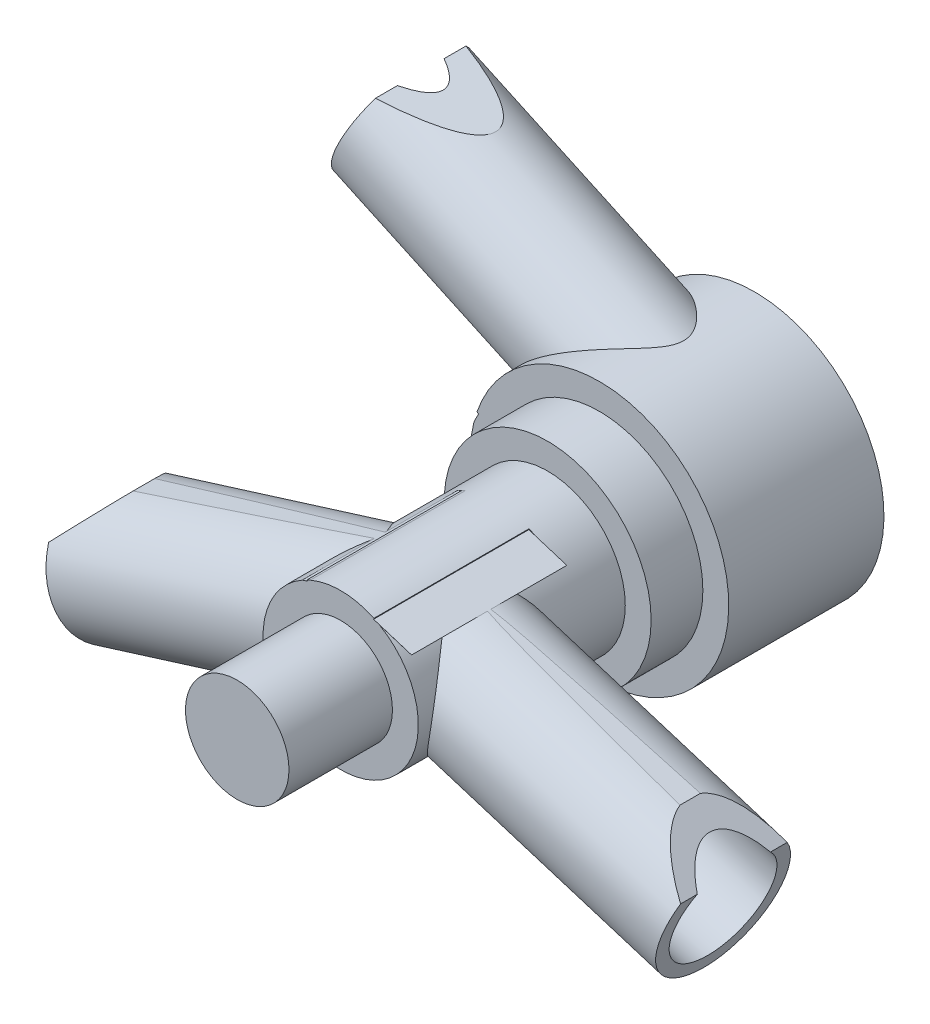
from build123d import *
from build123d.topology import SkipClean

# Parameters (mm, degrees)
SKETCH1_R                = 63.5
BOSS_EXTRUDE1_DEPTH      = 50.8
SKETCH3_R                = 50.8
BOSS_EXTRUDE2_DEPTH      = 25.4
SKETCH4_R                = 38.1
BOSS_EXTRUDE3_DEPTH      = 101.6
SKETCH5_R                = 25.4
BOSS_EXTRUDE4_DEPTH      = 50.8
BOSS_EXTRUDE8_START      = -76.2
BOSS_EXTRUDE8_DEPTH      = 76.2
CUT_EXTRUDE11_REACH      = 400.151
CUT_EXTRUDE11_END_RADIUS = 38.1
SKETCH14_W               = 149.462783348
SKETCH14_H               = 76.2
CUT_EXTRUDE14_DEPTH      = 0.508
CUT_EXTRUDE15_REACH      = 400.151
CUT_EXTRUDE15_END_RADIUS = 38.1
CUT_EXTRUDE16_REACH      = 400.177
CUT_EXTRUDE16_END_RADIUS = 38.1
SKETCH18_W               = 149.619958318
SKETCH18_H               = 76.2
CUT_EXTRUDE17_DEPTH      = 0.508
SKETCH19_R               = 25.4
CUT_EXTRUDE18_DEPTH      = 101.6
SKETCH20_R               = 25.4
CUT_EXTRUDE19_DEPTH      = 101.6
CUT_EXTRUDE22_DEPTH      = 254
BOSS_EXTRUDE9_START      = 25.4
SKETCH22_R               = 63.5
BOSS_EXTRUDE9_DEPTH      = 25.4
BOSS_EXTRUDE10_DEPTH     = 76.2
CUT_EXTRUDE23_REACH      = 405.156
CUT_EXTRUDE23_END_RADIUS = 63.5
SKETCH25_W               = 76.2
SKETCH25_H               = 71.543766187
SKETCH25_R               = 31.75
SKETCH26_W               = 99.244738203
SKETCH26_H               = 76.2
CUT_EXTRUDE24_DEPTH      = 2.54
SKETCH27_W               = 18.769862002
SKETCH27_H               = 76.2
CUT_EXTRUDE25_DEPTH      = 2.54
SKETCH28_R               = 25.4
CUT_EXTRUDE26_DEPTH      = 76.2
CUT_EXTRUDE27_DEPTH      = 50.8


with BuildPart() as part:
    # Sketch1 → Boss-Extrude1 (new body)
    with BuildSketch(Plane.XY):
        Circle(SKETCH1_R)
    extrude(amount=BOSS_EXTRUDE1_DEPTH)

    # Sketch3 → Boss-Extrude2 (add)
    with BuildSketch(Plane.XY.offset(50.8)):
        Circle(SKETCH3_R)
    extrude(amount=BOSS_EXTRUDE2_DEPTH)

    # Sketch4 → Boss-Extrude3 (add)
    with BuildSketch(Plane.XY.offset(76.2)):
        Circle(SKETCH4_R)
    extrude(amount=BOSS_EXTRUDE3_DEPTH)

    # Sketch5 → Boss-Extrude4 (add)
    with BuildSketch(Plane.XY.offset(177.8)):
        Circle(SKETCH5_R)
    extrude(amount=BOSS_EXTRUDE4_DEPTH)

    # Sketch8 → Boss-Extrude8 (add)
    with BuildSketch(Plane.XY.offset(177.8).offset(BOSS_EXTRUDE8_START)):
        with BuildLine():
            Line((16.300217306, 34.437086343), (127.497415133, -0.541997387))
            Line((127.497415133, -0.541997387), (159.018921737, -10.479544971))
            Line((159.018921737, -10.479544971), (140.197415126, -71.104671892))
            Line((140.197415126, -71.104671892), (19.05, -32.995567884))
            ThreePointArc((19.05, -32.995567884), (38.068361928, 1.552359521), (16.300217306, 34.437086343))
        make_face()
        with BuildLine():
            Line((-19.05, -32.995567884), (-140.197415132, -71.104671873))
            Line((-140.197415132, -71.104671873), (-159.088506914, -10.479544949))
            Line((-159.088506914, -10.479544949), (-127.497415131, -0.541997371))
            Line((-127.497415131, -0.541997371), (-16.513468637, 34.370004287))
            add(Edge.make_bspline(
                [(-16.513468637, 34.370004287), (-15.7344976, 34.722682489), (-14.95550815, 35.042014439)],
                knots=[0, 0, 0, 0.047490239, 0.047490239, 0.047490239], degree=2))
            ThreePointArc((-14.95550815, 35.042014439), (-38.031195067, 2.288711811), (-19.05, -32.995567884))
        make_face()
    extrude(amount=BOSS_EXTRUDE8_DEPTH)

    # Cut-Extrude11: up to this cylinder (the profile starts outside it)
    cut_extrude11_end = Plane(origin=(0, 0, 158.75), z_dir=(0, 0, -1)) * Cylinder(CUT_EXTRUDE11_END_RADIUS, 877.502, mode=Mode.PRIVATE)
    # Sketch12 → Cut-Extrude11 (cut, up to the surface)
    with BuildSketch(Plane(origin=(-147.984988274, -46.112860091, 0), x_dir=(0, 0, 1), z_dir=(-0.9547229320618802, -0.297496425180483, 0)), mode=Mode.PRIVATE) as cut_extrude11_sk1:
        with BuildLine():
            Line((139.7, -26.177030992), (177.8, -26.177030992))
            Line((177.8, -26.177030992), (177.8, 37.323200213))
            Line((177.8, 37.323200213), (139.7, 37.323200213))
            ThreePointArc((139.7, 37.323200213), (162.150722046, 28.023806657), (171.450115603, 5.573084611))
            ThreePointArc((171.450115603, 5.573084611), (162.150722046, -16.877637436), (139.7, -26.177030992))
        make_face()
    cut_extrude11_tool1 = extrude(cut_extrude11_sk1.sketch, amount=-CUT_EXTRUDE11_REACH, mode=Mode.PRIVATE) - cut_extrude11_end
    add(cut_extrude11_tool1.solids().sort_by_distance((-140.417721, -70.397668, 158.75))[0], mode=Mode.SUBTRACT)

    # Sketch14 → Cut-Extrude14 (cut)
    with BuildSketch(Plane(origin=(-11.325108646, 36.00209648, 0), x_dir=(0.9539166545833222, 0.3000716849497182, 0), z_dir=(-0.3000716849497182, 0.9539166545833222, 0))):
        with Locations((-80.170399334, -139.7)):
            Rectangle(SKETCH14_W, SKETCH14_H)
    extrude(amount=-CUT_EXTRUDE14_DEPTH, mode=Mode.SUBTRACT)

    # Cut-Extrude15: up to this cylinder (the profile starts outside it)
    cut_extrude15_end = Plane(origin=(0, 0, 107.209352), z_dir=(0, 0, -1)) * Cylinder(CUT_EXTRUDE15_END_RADIUS, 877.502, mode=Mode.PRIVATE)
    # Sketch16 → Cut-Extrude15 (cut, up to the surface)
    with BuildSketch(Plane(origin=(-147.984988274, -46.112860091, 0), x_dir=(0, 0, 1), z_dir=(-0.9547229320618802, -0.297496425180483, 0)), mode=Mode.PRIVATE) as cut_extrude15_sk1:
        with BuildLine():
            ThreePointArc((139.7, -26.177030992), (107.949884397, 5.573084611), (139.7, 37.323200213))
            Line((139.7, 37.323200213), (101.6, 37.323200213))
            Line((101.6, 37.323200213), (101.6, -26.177030992))
            Line((101.6, -26.177030992), (139.7, -26.177030992))
        make_face()
    cut_extrude15_tool1 = extrude(cut_extrude15_sk1.sketch, amount=-CUT_EXTRUDE15_REACH, mode=Mode.PRIVATE) - cut_extrude15_end
    add(cut_extrude15_tool1.solids().sort_by_distance((-149.642961, -40.792108, 107.209352))[0], mode=Mode.SUBTRACT)

    # Cut-Extrude16: up to this cylinder (the profile starts outside it)
    cut_extrude16_end = Plane(origin=(0, 0, 139.7), z_dir=(0, 0, -1)) * Cylinder(CUT_EXTRUDE16_END_RADIUS, 916.45943, mode=Mode.PRIVATE)
    # Sketch17 → Cut-Extrude16 (cut, up to the surface)
    with BuildSketch(Plane(origin=(148.006921889, -45.949813226, 0), x_dir=(0, 0, -1), z_dir=(0.9550337541962777, -0.29649709669027763, 0)), mode=Mode.PRIVATE) as cut_extrude16_sk1:
        with BuildLine():
            Line((-101.6, 37.140329438), (-138.894569251, 37.140329438))
            ThreePointArc((-138.894569251, 37.140329438), (-116.966380334, 27.56459542), (-107.95, 5.400547124))
            ThreePointArc((-107.95, 5.400547124), (-116.966380334, -16.763501172), (-138.894569251, -26.339235189))
            Line((-138.894569251, -26.339235189), (-101.6, -26.339235189))
            Line((-101.6, -26.339235189), (-101.6, 37.140329438))
        make_face()
    cut_extrude16_tool1 = extrude(cut_extrude16_sk1.sketch, amount=-CUT_EXTRUDE16_REACH, mode=Mode.PRIVATE) - cut_extrude16_end
    add(cut_extrude16_tool1.solids().sort_by_distance((140.415709, -70.401535, 120.247285))[0], mode=Mode.SUBTRACT)
    # Sketch17 → Cut-Extrude16 (cut, up to the surface)
    with BuildSketch(Plane(origin=(148.006921889, -45.949813226, 0), x_dir=(0, 0, -1), z_dir=(0.9550337541962777, -0.29649709669027763, 0)), mode=Mode.PRIVATE) as cut_extrude16_sk2:
        with BuildLine():
            Line((-140.505430749, 37.140329438), (-177.8, 37.140329438))
            Line((-177.8, 37.140329438), (-177.8, -26.339235189))
            Line((-177.8, -26.339235189), (-140.505430749, -26.339235189))
            ThreePointArc((-140.505430749, -26.339235189), (-171.45, 5.400547124), (-140.505430749, 37.140329438))
        make_face()
    cut_extrude16_tool2 = extrude(cut_extrude16_sk2.sketch, amount=-CUT_EXTRUDE16_REACH, mode=Mode.PRIVATE) - cut_extrude16_end
    add(cut_extrude16_tool2.solids().sort_by_distance((158.800628, -11.182682, 159.152715))[0], mode=Mode.SUBTRACT)

    # Sketch18 → Cut-Extrude17 (cut)
    with BuildSketch(Plane(origin=(11.325108653, 36.002096483, 0), x_dir=(0.9539166545365823, -0.3000716850983026, 0), z_dir=(0.3000716850983026, 0.9539166545365823, 0))):
        with Locations((80.025433391, -139.7)):
            Rectangle(SKETCH18_W, SKETCH18_H)
    extrude(amount=-CUT_EXTRUDE17_DEPTH, mode=Mode.SUBTRACT)

    # Sketch19 → Cut-Extrude18 (cut)
    with BuildSketch(Plane(origin=(-147.984988274, -46.112860091, 0), x_dir=(0, 0, 1), z_dir=(-0.9547229320618802, -0.297496425180483, 0))):
        with Locations(Location((139.7, 5.573084611, 0), (0, 0, 270))):
            Circle(SKETCH19_R)
    extrude(amount=-CUT_EXTRUDE18_DEPTH, mode=Mode.SUBTRACT)

    # Sketch20 → Cut-Extrude19 (cut)
    with BuildSketch(Plane(origin=(148.006921889, -45.949813226, 0), x_dir=(0, 0, -1), z_dir=(0.9550337541962777, -0.29649709669027763, 0))):
        with Locations(Location((-139.7, 5.400547124, 0), (0, 0, 90))):
            Circle(SKETCH20_R)
    extrude(amount=-CUT_EXTRUDE19_DEPTH, mode=Mode.SUBTRACT)

    # Sketch21 → Cut-Extrude22 (cut)
    with BuildSketch(Plane.XY):
        Polygon((-134.706587472, -3.342313812), (-169.109034498, -13.300388796), (-163.277695591, -33.446082434), align=None)
        Polygon((133.472750981, -2.954188312), (172.604020056, -13.300388796), (169.54998084, -37.732702528), align=None)
    extrude(amount=CUT_EXTRUDE22_DEPTH, mode=Mode.SUBTRACT)

    # Sketch22 → Boss-Extrude9 (add)
    with BuildSketch(Plane(origin=(0, 0, 0), x_dir=(-1, 0, 0), z_dir=(0, 0, -1)).offset(BOSS_EXTRUDE9_START)):
        Circle(SKETCH22_R)
    extrude(amount=-BOSS_EXTRUDE9_DEPTH)

    # Sketch23 → Boss-Extrude10 (add)
    with SkipClean():  # the faces are left unmerged after this step: merging them gives an invalid solid
        with BuildSketch(Plane(origin=(0, 0, -25.4), x_dir=(-1, 0, 0), z_dir=(0, 0, -1))):
            Polygon((-17.972201749, 60.903612079), (120.331979434, 124.916997142), (150.318307031, 59.960622263), (14.034490782, -8.248478512), align=None)
        extrude(amount=-BOSS_EXTRUDE10_DEPTH)

    # Cut-Extrude23: up to this cylinder (the profile starts outside it)
    with SkipClean():  # the faces are left unmerged after this step: merging them gives an invalid solid
        cut_extrude23_end = Plane(origin=(0, 0, -24.354775), z_dir=(0, 0, -1)) * Cylinder(CUT_EXTRUDE23_END_RADIUS, 938.312, mode=Mode.PRIVATE)
        # Sketch25 → Cut-Extrude23 (cut, up to the surface)
        with BuildSketch(Plane(origin=(-146.729039483, 67.735692673, 0), x_dir=(0, 0, 1), z_dir=(-0.9079250134731456, 0.4191326399957282, 0)), mode=Mode.PRIVATE) as cut_extrude23_sk1:
            with Locations((12.7, 27.208323004)):
                Rectangle(SKETCH25_W, SKETCH25_H)
            with Locations(Location((12.7, 27.208323004, 0), (0, 0, 270))):
                Circle(SKETCH25_R, mode=Mode.SUBTRACT)
        cut_extrude23_tool1 = extrude(cut_extrude23_sk1.sketch, amount=-CUT_EXTRUDE23_REACH, mode=Mode.PRIVATE) - cut_extrude23_end
        add(cut_extrude23_tool1.solids().sort_by_distance((-135.325143, 92.43881, -24.354775))[0], mode=Mode.SUBTRACT)

    # Sketch26 → Cut-Extrude24 (cut)
    with SkipClean():  # the faces are left unmerged after this step: merging them gives an invalid solid
        with BuildSketch(Plane(origin=(-6.112669117, -12.213295078, 0), x_dir=(0.8942507627886049, -0.4475662780549919, 0), z_dir=(-0.44756627805499183, -0.8942507627886048, 0))):
            with Locations((-111.636244159, 12.7)):
                Rectangle(SKETCH26_W, SKETCH26_H)
        extrude(amount=-CUT_EXTRUDE24_DEPTH, mode=Mode.SUBTRACT)

    # Sketch27 → Cut-Extrude25 (cut)
    with SkipClean():  # the faces are left unmerged after this step: merging them gives an invalid solid
        with BuildSketch(Plane(origin=(-4.975850771, -9.941898141, 0), x_dir=(0.8942507627886049, -0.44756627805499183, 0), z_dir=(-0.44756627805499183, -0.8942507627886049, 0))):
            with Locations((-71.398806058, 12.7)):
                Rectangle(SKETCH27_W, SKETCH27_H)
        extrude(amount=-CUT_EXTRUDE25_DEPTH, mode=Mode.SUBTRACT)

    # Sketch28 → Cut-Extrude26 (cut)
    with SkipClean():  # the faces are left unmerged after this step: merging them gives an invalid solid
        with BuildSketch(Plane(origin=(-146.729039483, 67.735692673, 0), x_dir=(0, 0, 1), z_dir=(-0.9079250134731456, 0.4191326399957282, 0))):
            with Locations(Location((12.7, 27.208323004, 0), (0, 0, 270))):
                Circle(SKETCH28_R)
        extrude(amount=-CUT_EXTRUDE26_DEPTH, mode=Mode.SUBTRACT)

    # Sketch29 → Cut-Extrude27 (cut, symmetric)
    with SkipClean():  # the faces are left unmerged after this step: merging them gives an invalid solid
        with BuildSketch(Plane.XY):
            Polygon((-130.197550187, 113.857939337), (-124.874565659, 125.388587009), (-78.751974974, 104.096648897), align=None)
        extrude(amount=CUT_EXTRUDE27_DEPTH, both=True, mode=Mode.SUBTRACT)


solid = part.part
